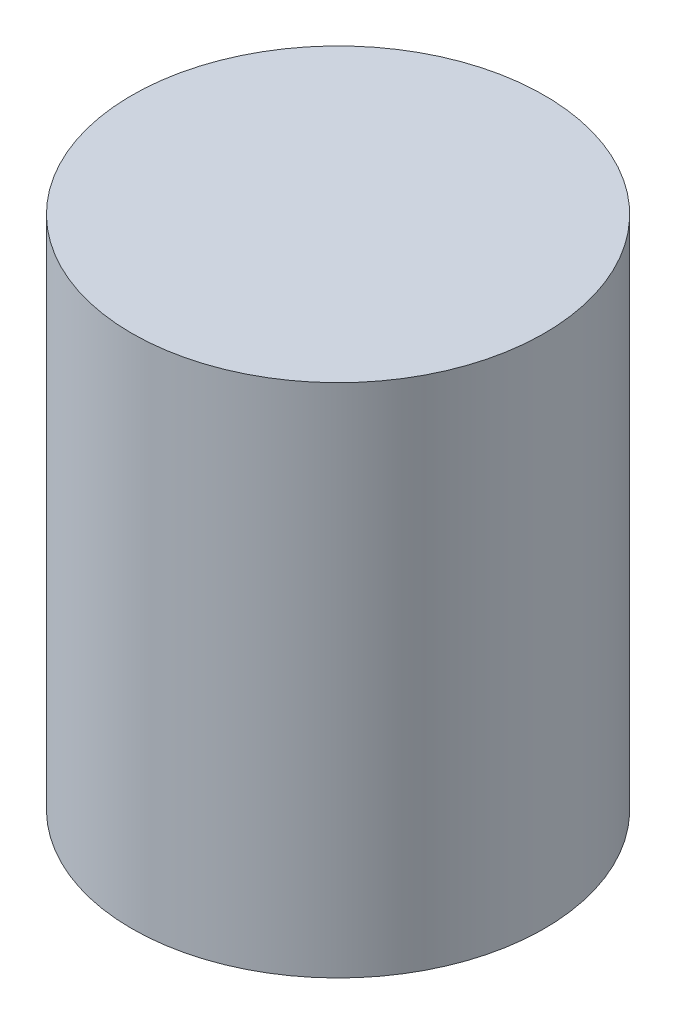
from build123d import *

# Parameters (mm, degrees)
SKETCH1_R           = 60
BOSS_EXTRUDE1_DEPTH = 150


with BuildPart() as part:
    # Sketch1 → Boss-Extrude1 (new body)
    with BuildSketch(Plane(origin=(0, 0, 0), x_dir=(1, 0, 0), z_dir=(0, 1, 0))):
        with Locations(Location((0, 0, 0), (0, 0, 270))):
            Circle(SKETCH1_R)
    extrude(amount=BOSS_EXTRUDE1_DEPTH)


solid = part.part
